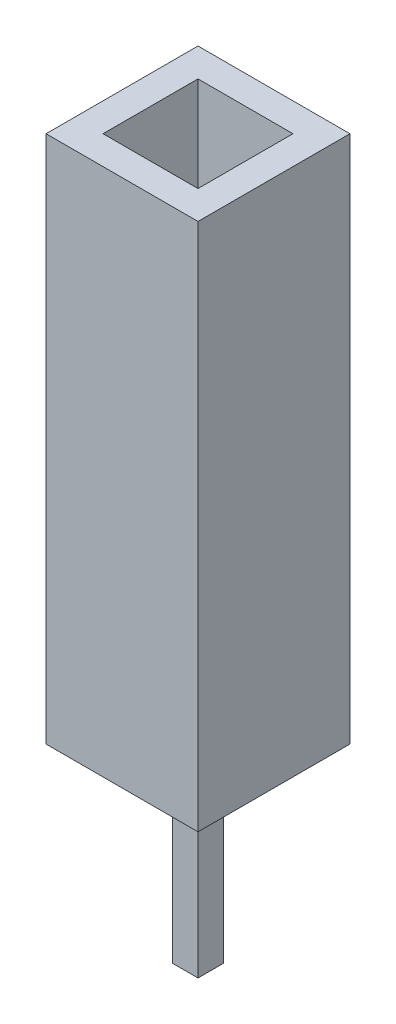
from build123d import *

# Parameters (mm, degrees)
SKETCH1_W           = 2.4
SKETCH1_H           = 2.4
BOSS_EXTRUDE1_DEPTH = 8.35
SKETCH2_W           = 1.5
SKETCH2_H           = 1.5
CUT_EXTRUDE1_DEPTH  = 8
SKETCH3_W           = 0.4
SKETCH3_H           = 0.4
BOSS_EXTRUDE2_DEPTH = 3


with BuildPart() as part:
    # Sketch1 → Boss-Extrude1 (new body)
    with BuildSketch(Plane(origin=(0, 0, 0), x_dir=(1, 0, 0), z_dir=(0, 1, 0))):
        Rectangle(SKETCH1_W, SKETCH1_H)
    extrude(amount=BOSS_EXTRUDE1_DEPTH)

    # Sketch2 → Cut-Extrude1 (cut)
    with BuildSketch(Plane(origin=(0, 8.35, 0), x_dir=(1, 0, 0), z_dir=(0, 1, 0))):
        Rectangle(SKETCH2_W, SKETCH2_H)
    extrude(amount=-CUT_EXTRUDE1_DEPTH, mode=Mode.SUBTRACT)

    # Sketch3 → Boss-Extrude2 (add)
    with BuildSketch(Plane.XZ):
        Rectangle(SKETCH3_W, SKETCH3_H)
    extrude(amount=BOSS_EXTRUDE2_DEPTH)


solid = part.part
